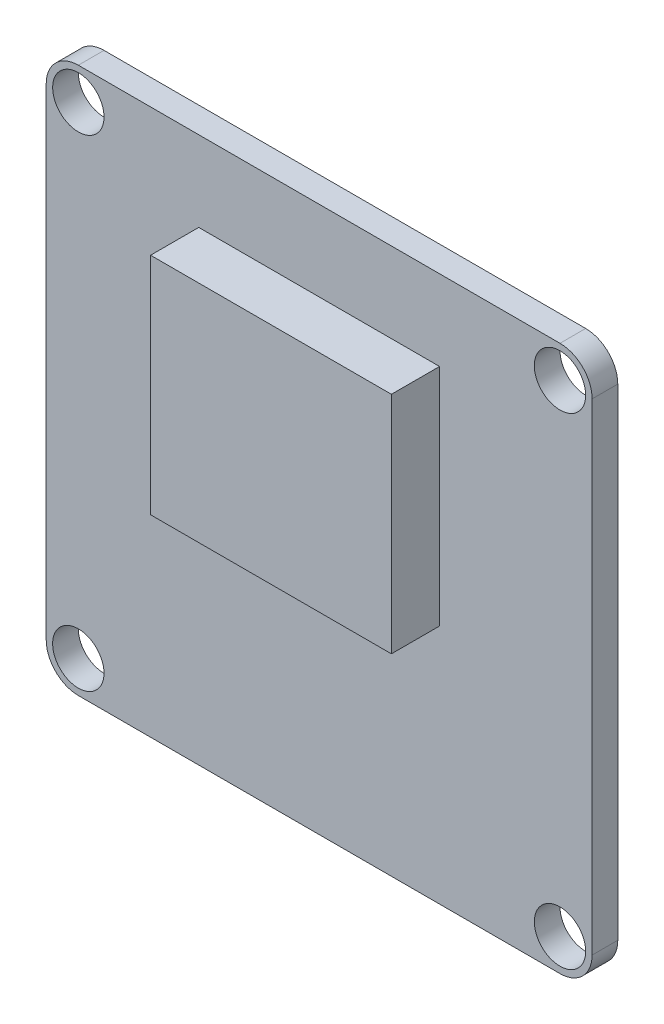
from build123d import *

# Parameters (mm, degrees)
SKETCH1_R           = 1.6
BOSS_EXTRUDE1_DEPTH = 1.6
SKETCH3_W           = 15
SKETCH3_H           = 14
BOSS_EXTRUDE2_DEPTH = 3


with BuildPart() as part:
    # Sketch1 → Boss-Extrude1 (new body)
    with BuildSketch(Plane.XY):
        with BuildLine():
            Line((-13.235657624, 13.611622239), (16.764342376, 13.611622239))
            ThreePointArc((16.764342376, 13.611622239), (18.178555938, 13.025835801), (18.764342376, 11.611622239))
            Line((18.764342376, 11.611622239), (18.764342376, -18.388377761))
            ThreePointArc((18.764342376, -18.388377761), (18.178555938, -19.802591324), (16.764342376, -20.388377761))
            Line((16.764342376, -20.388377761), (-13.235657624, -20.388377761))
            ThreePointArc((-13.235657624, -20.388377761), (-14.649871187, -19.802591324), (-15.235657624, -18.388377761))
            Line((-15.235657624, -18.388377761), (-15.235657624, 11.611622239))
            ThreePointArc((-15.235657624, 11.611622239), (-14.649871187, 13.025835801), (-13.235657624, 13.611622239))
        make_face()
        with Locations((16.764342376, 11.611622239)):
            Circle(SKETCH1_R, mode=Mode.SUBTRACT)
        with Locations(Location((16.764342376, -18.388377761, 0), (0, 0, 180))):
            Circle(SKETCH1_R, mode=Mode.SUBTRACT)
        with Locations(Location((-13.235657624, 11.611622239, 0), (0, 0, 180))):
            Circle(SKETCH1_R, mode=Mode.SUBTRACT)
        with Locations((-13.235657624, -18.388377761)):
            Circle(SKETCH1_R, mode=Mode.SUBTRACT)
    extrude(amount=BOSS_EXTRUDE1_DEPTH)

    # Sketch3 → Boss-Extrude2 (add)
    with BuildSketch(Plane.XY.offset(1.6)):
        with Locations((1.764342376, 1.611622239)):
            Rectangle(SKETCH3_W, SKETCH3_H)
    extrude(amount=BOSS_EXTRUDE2_DEPTH)


solid = part.part
